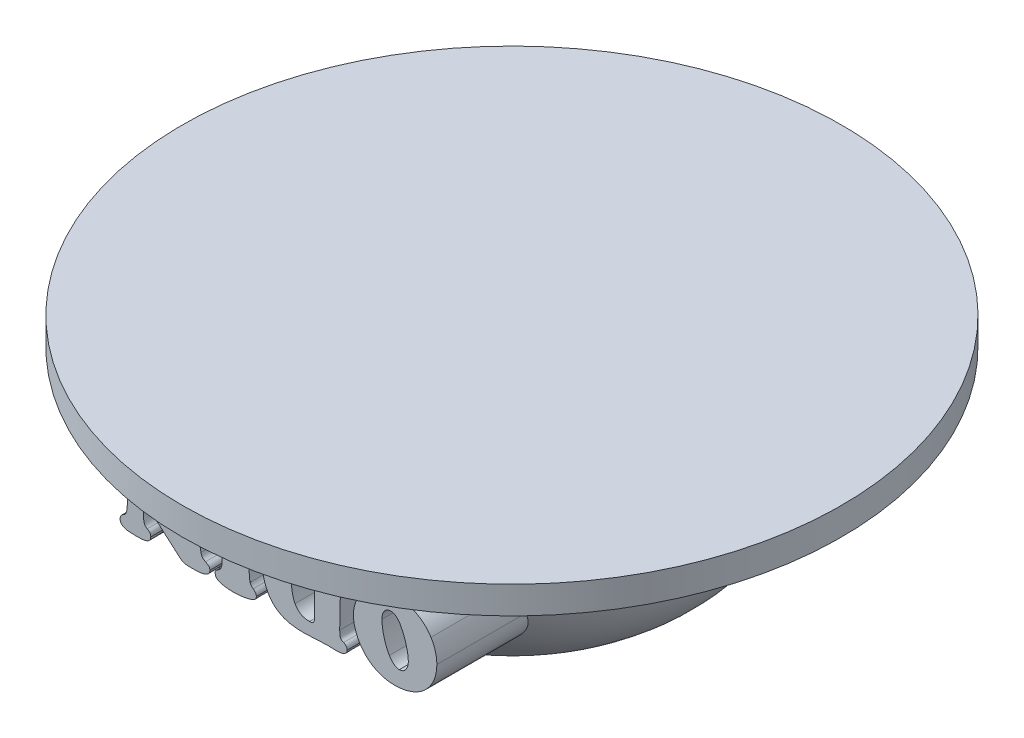
from build123d import *

# Parameters (mm, degrees)
ESQUISSE1_R        = 16
BOSS_EXTRU_1_DEPTH = 15
CONG_4_R           = 10
ESQUISSE5_R        = 24
BOSS_EXTRU_4_DEPTH = 2
BOSS_EXTRU_5_DEPTH = 17


with BuildPart() as part:
    # Esquisse1 → Boss.-Extru.1 (new body)
    with BuildSketch(Plane(origin=(0, 0, 0), x_dir=(1, 0, 0), z_dir=(0, 1, 0))):
        with Locations(Location((0, 0, 0), (0, 0, 270))):
            Circle(ESQUISSE1_R)
    extrude(amount=BOSS_EXTRU_1_DEPTH)

    # Congé4
    cong_4_edges = [part.edges().sort_by_distance(p)[0] for p in [
        (0, 0, -16),
    ]]
    fillet(cong_4_edges, radius=CONG_4_R)

    # Esquisse5 → Boss.-Extru.4 (add)
    with BuildSketch(Plane(origin=(0, 15, 0), x_dir=(1, 0, 0), z_dir=(0, 1, 0))):
        with Locations(Location((0, 0, 0), (0, 0, 270))):
            Circle(ESQUISSE5_R)
    extrude(amount=-BOSS_EXTRU_4_DEPTH)

    # Esquisse6 → Boss.-Extru.5 (add)
    # profile 1 of 4: a face of its own
    with BuildSketch(Plane.XY):
        with BuildLine():
            add(Edge.make_bspline(
                [(8.452336932, 4.388330518), (8.366979406, 4.390217829), (8.198217113, 4.393949274), (7.949668758, 4.422321264), (7.708834829, 4.467403215), (7.47713297, 4.533236034), (7.251891413, 4.613813805), (7.037143675, 4.717994283), (6.827615612, 4.835146417), (6.697818257, 4.929496384), (6.632628185, 4.976883182)],
                knots=[0, 0, 0, 0, 1.051895872, 2.079727092, 3.079536395, 4.068569728, 5.045898846, 6.023800936, 7.007463913, 8, 8, 8, 8], degree=3))
            add(Edge.make_bspline(
                [(6.632628185, 4.976883182), (6.589330819, 5.011171196), (6.502484112, 5.079946769), (6.38039795, 5.193057504), (6.264936059, 5.314098282), (6.154081228, 5.44077198), (6.050649596, 5.576558935), (5.952159554, 5.718824645), (5.860630697, 5.869412919), (5.805329649, 5.973930246), (5.77742513, 6.026668954)],
                knots=[0, 0, 0, 0, 0.970644245, 1.946937291, 2.922621233, 3.910516206, 4.904410596, 5.921583779, 6.951245804, 8, 8, 8, 8], degree=3))
            add(Edge.make_bspline(
                [(5.77742513, 6.026668954), (5.751969108, 6.07963941), (5.701450823, 6.184760967), (5.637607446, 6.345582131), (5.580933586, 6.505816314), (5.53791165, 6.666833256), (5.500004199, 6.826626585), (5.477468459, 6.987515653), (5.460311231, 7.147753032), (5.458717371, 7.254975434), (5.457925113, 7.308272408)],
                knots=[0, 0, 0, 0, 1.058087134, 2.099807599, 3.114551819, 4.116923791, 5.100022616, 6.069809804, 7.040561529, 8, 8, 8, 8], degree=3))
            add(Edge.make_bspline(
                [(5.457925113, 7.308272408), (5.459614248, 7.386051364), (5.462961908, 7.540199785), (5.494527196, 7.768001675), (5.543029466, 7.990192615), (5.613716531, 8.205167309), (5.701029213, 8.41507827), (5.811797345, 8.616720214), (5.939963578, 8.813784923), (6.039359962, 8.937022894), (6.08971838, 8.999460471)],
                knots=[0, 0, 0, 0, 1.011582123, 2.004832598, 2.986966838, 3.967275341, 4.945546629, 5.940967282, 6.9568068, 8, 8, 8, 8], degree=3))
            add(Edge.make_bspline(
                [(6.08971838, 8.999460471), (6.135435825, 9.050996364), (6.226649976, 9.153819319), (6.376177751, 9.29544137), (6.535995672, 9.426250775), (6.705983917, 9.545535995), (6.885948488, 9.655175404), (7.077767532, 9.749864126), (7.277886356, 9.837840223), (7.417369074, 9.884927373), (7.487831239, 9.908714281)],
                knots=[0, 0, 0, 0, 0.977993035, 1.95126404, 2.921007604, 3.908524287, 4.898281, 5.91032505, 6.944363697, 8, 8, 8, 8], degree=3))
            add(Edge.make_bspline(
                [(7.487831239, 9.908714281), (7.575966192, 9.934518045), (7.751103703, 9.985794038), (8.018314472, 10.037843815), (8.285774011, 10.070312365), (8.46425732, 10.074689949), (8.553231674, 10.076872185)],
                knots=[0, 0, 0, 0, 1.017501807, 2.021930326, 3.013927564, 4, 4, 4, 4], degree=3))
            add(Edge.make_bspline(
                [(8.553231674, 10.076872185), (8.611307339, 10.075844791), (8.726804982, 10.073801567), (8.899286168, 10.060548619), (9.069943929, 10.037226279), (9.238991924, 10.00679762), (9.40550123, 9.965054116), (9.570472829, 9.916078876), (9.733653215, 9.857401267), (9.840262151, 9.811570224), (9.893690394, 9.788601492)],
                knots=[0, 0, 0, 0, 1.009044969, 2.00673235, 3.003327838, 4.000699905, 4.989373689, 5.984146689, 6.989732889, 8, 8, 8, 8], degree=3))
            add(Edge.make_bspline(
                [(9.893690394, 9.788601492), (9.957084916, 9.758800156), (10.082717972, 9.699740906), (10.260013432, 9.593998792), (10.428341177, 9.479718065), (10.586096853, 9.353960704), (10.731167869, 9.214641873), (10.867854285, 9.066398533), (10.994633246, 8.907271704), (11.068529002, 8.792722077), (11.105628431, 8.735212336)],
                knots=[0, 0, 0, 0, 1.030857394, 2.04291731, 3.035438857, 4.025155278, 5.009237461, 5.993884518, 6.992827961, 8, 8, 8, 8], degree=3))
            add(Edge.make_bspline(
                [(11.105628431, 8.735212336), (11.139677016, 8.678011215), (11.207257535, 8.56447694), (11.293770766, 8.386898014), (11.366949892, 8.20542072), (11.427905212, 8.019865973), (11.47270492, 7.829178215), (11.507195063, 7.634419723), (11.526044606, 7.434761638), (11.529225958, 7.300299995), (11.530827703, 7.232601351)],
                knots=[0, 0, 0, 0, 1.00927234, 2.003230034, 2.99214822, 3.975344988, 4.962135542, 5.960442695, 6.973125272, 8, 8, 8, 8], degree=3))
            add(Edge.make_bspline(
                [(11.530827703, 7.232601351), (11.529246645, 7.15406167), (11.526132592, 6.999369782), (11.500390231, 6.770737476), (11.457092107, 6.549492161), (11.397012591, 6.334921237), (11.319609918, 6.12732646), (11.225996352, 5.926726576), (11.115233952, 5.732605235), (11.028248321, 5.611159662), (10.984314515, 5.549821183)],
                knots=[0, 0, 0, 0, 1.046408287, 2.061007504, 3.06133757, 4.047798165, 5.026959698, 6.010371128, 6.995098758, 8, 8, 8, 8], degree=3))
            add(Edge.make_bspline(
                [(10.984314515, 5.549821183), (10.94271603, 5.496655825), (10.860079495, 5.391041375), (10.721280791, 5.245438705), (10.574141354, 5.109032205), (10.414206348, 4.985310316), (10.245030274, 4.871083261), (10.065235642, 4.767549353), (9.87517742, 4.674336592), (9.742348268, 4.622417082), (9.675085119, 4.596125642)],
                knots=[0, 0, 0, 0, 0.985932074, 1.958581229, 2.935812373, 3.915405102, 4.910134066, 5.916682345, 6.945032, 8, 8, 8, 8], degree=3))
            add(Edge.make_bspline(
                [(9.675085119, 4.596125642), (9.58116427, 4.563723057), (9.391096872, 4.498150023), (9.090785834, 4.435174788), (8.776505334, 4.395790424), (8.561763751, 4.390848696), (8.452336932, 4.388330518)],
                knots=[0, 0, 0, 0, 0.955506866, 1.933656958, 2.94704443, 4, 4, 4, 4], degree=3))
        make_face()
        with BuildLine():
            add(Edge.make_bspline(
                [(8.798261763, 5.541413288), (8.824368923, 5.542263022), (8.875792548, 5.543936754), (8.950636814, 5.559397532), (9.022436377, 5.58125942), (9.088556193, 5.615886988), (9.150833971, 5.658433619), (9.208681543, 5.710414279), (9.261978049, 5.772445412), (9.292821821, 5.818913149), (9.308741114, 5.842896388)],
                knots=[0, 0, 0, 0, 1.006775924, 1.983060122, 2.941306894, 3.895429469, 4.851678852, 5.847954811, 6.889272089, 8, 8, 8, 8], degree=3))
            add(Edge.make_bspline(
                [(9.308741114, 5.842896388), (9.331184683, 5.881533178), (9.37675921, 5.959990103), (9.422949196, 6.090315147), (9.449639809, 6.231368164), (9.453357303, 6.328431538), (9.455278716, 6.378599425)],
                knots=[0, 0, 0, 0, 0.951073107, 1.931275122, 2.930765027, 4, 4, 4, 4], degree=3))
            add(Edge.make_bspline(
                [(9.455278716, 6.378599425), (9.453110013, 6.457580749), (9.448589663, 6.622205995), (9.412342032, 6.877018359), (9.356523587, 7.149619007), (9.280705752, 7.434224284), (9.188999317, 7.719870405), (9.083591689, 7.993973578), (8.966070879, 8.251213118), (8.876927833, 8.413020621), (8.833094471, 8.492584503)],
                knots=[0, 0, 0, 0, 0.851887102, 1.775636513, 2.771927568, 3.853257604, 4.951607259, 6.007335301, 7.020168178, 8, 8, 8, 8], degree=3))
            add(Edge.make_bspline(
                [(8.833094471, 8.492584503), (8.812442325, 8.524206457), (8.771881786, 8.58631155), (8.702067255, 8.671577431), (8.623120042, 8.744464901), (8.540157832, 8.808500902), (8.452448651, 8.858355047), (8.364380049, 8.897048621), (8.274081927, 8.919494581), (8.213427558, 8.922363603), (8.183284285, 8.923789414)],
                knots=[0, 0, 0, 0, 1.114232618, 2.188337959, 3.241574703, 4.278985454, 5.274085398, 6.211166208, 7.111007086, 8, 8, 8, 8], degree=3))
            add(Edge.make_bspline(
                [(8.183284285, 8.923789414), (8.136419, 8.921350137), (8.045706044, 8.916628646), (7.917785003, 8.87004776), (7.802826889, 8.798518298), (7.707484874, 8.695089234), (7.629239328, 8.570925477), (7.572453035, 8.426423128), (7.538795835, 8.263914387), (7.535294582, 8.149629373), (7.533474099, 8.090206662)],
                knots=[0, 0, 0, 0, 0.946349272, 1.831763911, 2.725506388, 3.666832243, 4.655183083, 5.685900382, 6.796779471, 8, 8, 8, 8], degree=3))
            add(Edge.make_bspline(
                [(7.533474099, 8.090206662), (7.5355129, 8.007261443), (7.539679788, 7.837738473), (7.568420957, 7.579259047), (7.615788094, 7.311382114), (7.681100663, 7.039263041), (7.759861768, 6.772009046), (7.850419658, 6.520345196), (7.953588083, 6.289566308), (8.032950336, 6.14667011), (8.071579392, 6.077116325)],
                knots=[0, 0, 0, 0, 0.945659483, 1.932733523, 2.961681864, 4.04567364, 5.121744827, 6.13695095, 7.093173116, 8, 8, 8, 8], degree=3))
            add(Edge.make_bspline(
                [(8.071579392, 6.077116325), (8.095941825, 6.037672152), (8.143528325, 5.960626885), (8.227407658, 5.858283021), (8.31375511, 5.765957156), (8.407491684, 5.690317262), (8.502596366, 5.626229935), (8.601438228, 5.582642102), (8.698962072, 5.549707146), (8.765582999, 5.544142733), (8.798261763, 5.541413288)],
                knots=[0, 0, 0, 0, 1.183808741, 2.312302484, 3.376393325, 4.409059223, 5.385626283, 6.297054649, 7.164674646, 8, 8, 8, 8], degree=3))
        make_face(mode=Mode.SUBTRACT)
    # profile 2 of 4: a face of its own
    with BuildSketch(Plane.XY):
        with BuildLine():
            Line((3.413605451, 10), (3.703077272, 10))
            add(Edge.make_bspline(
                [(3.703077272, 10), (3.746742136, 10.000252618), (3.836578998, 10.000772358), (3.97461196, 10.01230488), (4.120283027, 10.023914917), (4.219224335, 10.038273027), (4.270009634, 10.04564286)],
                knots=[0, 0, 0, 0, 0.920125843, 1.893083154, 2.918546723, 4, 4, 4, 4], degree=3))
            add(Edge.make_bspline(
                [(4.270009634, 10.04564286), (4.300453207, 10.049914324), (4.356126219, 10.057725669), (4.431874564, 10.070198482), (4.492984273, 10.074318935), (4.528652394, 10.076108737), (4.543866792, 10.076872185)],
                knots=[0, 0, 0, 0, 1.337601017, 2.446108267, 3.337180453, 4, 4, 4, 4], degree=3))
            add(Edge.make_bspline(
                [(4.543866792, 10.076872185), (4.586808236, 10.075195272), (4.668940131, 10.071987927), (4.786350827, 10.049436818), (4.891053515, 10.009831752), (4.981315731, 9.954149725), (5.056927894, 9.887941278), (5.111691319, 9.808909237), (5.144442815, 9.719365796), (5.148405268, 9.656348752), (5.150436374, 9.624046972)],
                knots=[0, 0, 0, 0, 1.219451387, 2.332381986, 3.379942845, 4.380522973, 5.330648641, 6.213899374, 7.084466267, 8, 8, 8, 8], degree=3))
            add(Edge.make_bspline(
                [(5.150436374, 9.624046972), (5.14952571, 9.60155408), (5.147800458, 9.558941337), (5.134586418, 9.498609736), (5.111966096, 9.445847509), (5.078063143, 9.401178662), (5.034268594, 9.363304638), (4.980134634, 9.329151436), (4.913944782, 9.299841436), (4.86513334, 9.284058604), (4.839344251, 9.275719885)],
                knots=[0, 0, 0, 0, 1.055878958, 2.000360711, 2.884492829, 3.730810764, 4.61012906, 5.590985579, 6.727218747, 8, 8, 8, 8], degree=3))
            add(Edge.make_bspline(
                [(4.839344251, 9.275719885), (4.815121274, 9.268314669), (4.770001153, 9.254520978), (4.708768521, 9.225973478), (4.661511889, 9.188554215), (4.624540088, 9.142781988), (4.597371789, 9.08261062), (4.576398592, 9.004213599), (4.555509328, 8.904839391), (4.546442677, 8.831004209), (4.541464536, 8.790464219)],
                knots=[0, 0, 0, 0, 0.978903518, 1.823402852, 2.594502993, 3.288247987, 4.077465234, 5.125623634, 6.42179318, 8, 8, 8, 8], degree=3))
            add(Edge.make_bspline(
                [(4.541464536, 8.790464219), (4.539083888, 8.762036149), (4.533853677, 8.699580546), (4.524727883, 8.596790432), (4.518372083, 8.476180768), (4.510877358, 8.337267049), (4.50399253, 8.180702106), (4.496236898, 8.005770088), (4.491221321, 7.813126123), (4.475298829, 7.387278911), (4.462352319, 6.735810548), (4.459839516, 6.154392988), (4.458586712, 5.86451669)],
                knots=[0, 0, 0, 0, 0.292319061, 0.642216047, 1.057303786, 1.529738379, 2.067735435, 2.663113798, 3.323942291, 4.042309848, 7.029685223, 10, 10, 10, 10], degree=3))
            add(Edge.make_bspline(
                [(4.458586712, 5.86451669), (4.459449699, 5.812873641), (4.461023159, 5.718714286), (4.467734978, 5.590857453), (4.48318901, 5.491323698), (4.502007978, 5.413776611), (4.537954741, 5.353748593), (4.590384861, 5.306463029), (4.657174237, 5.263101281), (4.709159133, 5.241820119), (4.737248381, 5.230321166)],
                knots=[0, 0, 0, 0, 1.635549864, 2.982053256, 4.046925476, 4.825190199, 5.490369365, 6.225534096, 7.041194322, 8, 8, 8, 8], degree=3))
            add(Edge.make_bspline(
                [(4.737248381, 5.230321166), (4.75796656, 5.221277356), (4.797854972, 5.203865437), (4.850682169, 5.169627519), (4.896853618, 5.132478611), (4.932412372, 5.088327555), (4.962673746, 5.040946914), (4.98245549, 4.98772085), (4.995125566, 4.930238949), (4.996159306, 4.890474107), (4.996692005, 4.8699828)],
                knots=[0, 0, 0, 0, 1.139394589, 2.193660095, 3.169421207, 4.116708503, 5.042396773, 5.995918412, 6.967272364, 8, 8, 8, 8], degree=3))
            add(Edge.make_bspline(
                [(4.996692005, 4.8699828), (4.994582528, 4.838345494), (4.990454747, 4.776438263), (4.951535081, 4.690411105), (4.890211827, 4.615480065), (4.803864165, 4.555388333), (4.698701099, 4.506252252), (4.574085018, 4.472052292), (4.431200041, 4.452234917), (4.329734764, 4.449718956), (4.276015273, 4.448386912)],
                knots=[0, 0, 0, 0, 0.813299906, 1.591448539, 2.392624287, 3.288351079, 4.283039008, 5.379758877, 6.612746904, 8, 8, 8, 8], degree=3))
            add(Edge.make_bspline(
                [(4.276015273, 4.448386912), (4.235176047, 4.44872131), (4.146686619, 4.449445876), (4.058209555, 4.451099724), (4.01056601, 4.451990296)],
                knots=[0, 0, 0, 0, 0.92303062, 2, 2, 2, 2], degree=3))
            add(Edge.make_bspline(
                [(4.01056601, 4.451990296), (3.958522374, 4.45415076), (3.862058096, 4.458155238), (3.728706853, 4.461429672), (3.618205799, 4.46406445), (3.55213645, 4.464853594), (3.522908089, 4.465202703)],
                knots=[0, 0, 0, 0, 1.281213718, 2.374764056, 3.281013318, 4, 4, 4, 4], degree=3))
            add(Edge.make_bspline(
                [(3.522908089, 4.465202703), (3.424402857, 4.464568311), (3.220916964, 4.463257824), (2.906588206, 4.450015547), (2.57334705, 4.431484577), (2.345363731, 4.412506246), (2.228092228, 4.402744053)],
                knots=[0, 0, 0, 0, 0.911540002, 1.883001812, 2.911045071, 4, 4, 4, 4], degree=3))
            add(Edge.make_bspline(
                [(2.228092228, 4.402744053), (2.201274658, 4.400638012), (2.144079525, 4.396146356), (2.053580921, 4.391297119), (1.953442805, 4.3892948), (1.883769192, 4.388661625), (1.847334688, 4.388330518)],
                knots=[0, 0, 0, 0, 0.846918924, 1.806265073, 2.852827644, 4, 4, 4, 4], degree=3))
            add(Edge.make_bspline(
                [(1.847334688, 4.388330518), (1.772856725, 4.389108385), (1.627841397, 4.390622962), (1.416262604, 4.39986217), (1.216797981, 4.416950452), (1.029112661, 4.439056065), (0.854005634, 4.469163407), (0.690700377, 4.505005771), (0.539324413, 4.547611255), (0.44382013, 4.582725416), (0.39757333, 4.599729026)],
                knots=[0, 0, 0, 0, 1.213424847, 2.362647857, 3.449300149, 4.474398554, 5.44060886, 6.342687041, 7.197466145, 8, 8, 8, 8], degree=3))
            add(Edge.make_bspline(
                [(0.39757333, 4.599729026), (0.333034838, 4.627546074), (0.205614379, 4.682466182), (0.024482201, 4.781682295), (-0.144496322, 4.89440999), (-0.299343655, 5.022824227), (-0.443821822, 5.162516453), (-0.574391961, 5.317190359), (-0.694663911, 5.483988419), (-0.762240281, 5.604369884), (-0.796347788, 5.665129461)],
                knots=[0, 0, 0, 0, 1.03142596, 2.036378062, 3.027688743, 4.00920738, 4.986138137, 5.974463699, 6.977660484, 8, 8, 8, 8], degree=3))
            add(Edge.make_bspline(
                [(-0.796347788, 5.665129461), (-0.825303525, 5.720744869), (-0.883630982, 5.832774666), (-0.954833745, 6.010506095), (-1.016061422, 6.195461676), (-1.066789132, 6.387915363), (-1.105044224, 6.588638352), (-1.132250127, 6.797198082), (-1.149508414, 7.013707928), (-1.151879411, 7.160501157), (-1.15308277, 7.235003607)],
                knots=[0, 0, 0, 0, 0.924728864, 1.862742562, 2.821148645, 3.798433486, 4.797196575, 5.83410876, 6.900738101, 8, 8, 8, 8], degree=3))
            add(Edge.make_bspline(
                [(-1.15308277, 7.235003607), (-1.15146646, 7.311546299), (-1.148216785, 7.465439366), (-1.121676923, 7.695732662), (-1.081072996, 7.92656752), (-1.023605386, 8.154789152), (-0.952852439, 8.376173406), (-0.868292241, 8.584183338), (-0.774655482, 8.778099833), (-0.699763364, 8.896790945), (-0.663022593, 8.955018739)],
                knots=[0, 0, 0, 0, 1.013585565, 2.037866532, 3.066695254, 4.116240773, 5.152681626, 6.142387353, 7.088687549, 8, 8, 8, 8], degree=3))
            add(Edge.make_bspline(
                [(-0.663022593, 8.955018739), (-0.623135524, 9.010615782), (-0.544034284, 9.120871939), (-0.409202826, 9.272325352), (-0.265156016, 9.412233836), (-0.10948499, 9.539241776), (0.058121518, 9.651630986), (0.235690079, 9.753261027), (0.424191908, 9.842836779), (0.556486776, 9.890578158), (0.623385373, 9.91471992)],
                knots=[0, 0, 0, 0, 1.004579795, 1.992212232, 2.973854545, 3.95214334, 4.939075006, 5.934869834, 6.955709227, 8, 8, 8, 8], degree=3))
            add(Edge.make_bspline(
                [(0.623385373, 9.91471992), (0.704670167, 9.939874386), (0.868303446, 9.990512489), (1.123182934, 10.038960321), (1.385215017, 10.072224126), (1.562959014, 10.075312165), (1.652751971, 10.076872185)],
                knots=[0, 0, 0, 0, 0.975039071, 1.962837489, 2.970863437, 4, 4, 4, 4], degree=3))
            Line((1.652751971, 10.076872185), (2.139208764, 10.049246243))
            Line((2.139208764, 10.049246243), (2.557201269, 10.027625941))
            add(Edge.make_bspline(
                [(2.557201269, 10.027625941), (2.635663432, 10.023354393), (2.788140995, 10.015053383), (3.0096022, 10.007409912), (3.216574229, 10.000144269), (3.349539281, 10.00004691), (3.413605451, 10)],
                knots=[0, 0, 0, 0, 1.1002948, 2.138231499, 3.10294941, 4, 4, 4, 4], degree=3))
        make_face()
        with BuildLine():
            Line((2.613654279, 5.644710286), (2.613654279, 8.764039406))
            add(Edge.make_bspline(
                [(2.613654279, 8.764039406), (2.61235292, 8.803366622), (2.609928611, 8.876629507), (2.590500011, 8.977818709), (2.555869837, 9.061409684), (2.504551847, 9.127357296), (2.435608596, 9.176067051), (2.349512147, 9.209109044), (2.245256915, 9.227291418), (2.170112164, 9.229881679), (2.129599741, 9.231278153)],
                knots=[0, 0, 0, 0, 1.205062784, 2.244918024, 3.140973218, 3.953721306, 4.771274222, 5.696607523, 6.758183262, 8, 8, 8, 8], degree=3))
            add(Edge.make_bspline(
                [(2.129599741, 9.231278153), (2.080682076, 9.229870178), (1.985604804, 9.227133612), (1.847706912, 9.206646174), (1.719256541, 9.172059937), (1.600794488, 9.122284924), (1.491271831, 9.05963889), (1.391878403, 8.981498653), (1.301629339, 8.889781423), (1.220459202, 8.784182725), (1.14952328, 8.664261202), (1.088676055, 8.530375913), (1.036820661, 8.38285873), (0.995812123, 8.221487118), (0.961368149, 8.046810846), (0.940028741, 7.857600907), (0.924875462, 7.654844284), (0.923285403, 7.514898044), (0.922466216, 7.442798731)],
                knots=[0, 0, 0, 0, 0.958663437, 1.863275827, 2.72578016, 3.5595238, 4.375305652, 5.191691341, 6.029709106, 6.891534709, 7.796044954, 8.754772642, 9.770012496, 10.856982038, 12.016025252, 13.257216196, 14.586937197, 16, 16, 16, 16], degree=3))
            add(Edge.make_bspline(
                [(0.922466216, 7.442798731), (0.923402289, 7.362701448), (0.9252196, 7.207199027), (0.938840628, 6.98082338), (0.959334149, 6.768185182), (0.991441718, 6.570023243), (1.028194747, 6.384814783), (1.078831798, 6.214604194), (1.133168844, 6.055997809), (1.180548573, 5.958602389), (1.203530141, 5.911360677)],
                knots=[0, 0, 0, 0, 1.22377343, 2.375857482, 3.464265223, 4.4861315, 5.442383993, 6.34657505, 7.198005137, 8, 8, 8, 8], degree=3))
            add(Edge.make_bspline(
                [(1.203530141, 5.911360677), (1.230303614, 5.86371364), (1.282654325, 5.770548431), (1.381076757, 5.646703762), (1.493699804, 5.542165028), (1.620232377, 5.457713363), (1.758941167, 5.390273644), (1.912120077, 5.343845455), (2.078552499, 5.316242991), (2.193951651, 5.312646738), (2.253315914, 5.310796734)],
                knots=[0, 0, 0, 0, 1.023954712, 2.002159235, 2.953470404, 3.89497782, 4.84557724, 5.836158065, 6.886864599, 8, 8, 8, 8], degree=3))
            add(Edge.make_bspline(
                [(2.253315914, 5.310796734), (2.284230556, 5.311490731), (2.341253055, 5.312770817), (2.419257905, 5.327417592), (2.484014024, 5.348984385), (2.534750367, 5.383762814), (2.571722102, 5.431783626), (2.595886113, 5.491957558), (2.611878552, 5.564216306), (2.613033758, 5.616581953), (2.613654279, 5.644710286)],
                knots=[0, 0, 0, 0, 1.292446209, 2.383935493, 3.311943636, 4.130388962, 4.918400696, 5.812011858, 6.824716918, 8, 8, 8, 8], degree=3))
        make_face(mode=Mode.SUBTRACT)
    # profile 3 of 4: a face of its own
    with BuildSketch(Plane.XY):
        with BuildLine():
            add(Edge.make_bspline(
                [(-3.283883639, 4.388330518), (-3.354783787, 4.38911131), (-3.494760125, 4.390652806), (-3.701162237, 4.407123039), (-3.901728742, 4.431617961), (-4.032301402, 4.456478653), (-4.097047218, 4.468806086)],
                knots=[0, 0, 0, 0, 1.039250674, 2.051765891, 3.033947791, 4, 4, 4, 4], degree=3))
            add(Edge.make_bspline(
                [(-4.097047218, 4.468806086), (-4.13770666, 4.478406708), (-4.214505361, 4.496540633), (-4.320204286, 4.534592411), (-4.409716604, 4.581851149), (-4.483302475, 4.636783667), (-4.542381482, 4.698950892), (-4.582685092, 4.770825834), (-4.607590805, 4.850348339), (-4.610725964, 4.90623252), (-4.612331081, 4.934843706)],
                knots=[0, 0, 0, 0, 1.321013805, 2.495168172, 3.543498325, 4.511213695, 5.389680449, 6.234918693, 7.096326217, 8, 8, 8, 8], degree=3))
            add(Edge.make_bspline(
                [(-4.612331081, 4.934843706), (-4.612281968, 4.953353593), (-4.61219039, 4.987868288), (-4.600957109, 5.035381006), (-4.589694934, 5.07719259), (-4.566348719, 5.11329995), (-4.530212959, 5.147364044), (-4.479316058, 5.186182008), (-4.411989786, 5.233346176), (-4.35992275, 5.264708893), (-4.331267156, 5.281969665)],
                knots=[0, 0, 0, 0, 0.928144258, 1.730675938, 2.45102501, 3.094188585, 3.863897141, 4.940606375, 6.316233311, 8, 8, 8, 8], degree=3))
            add(Edge.make_bspline(
                [(-4.331267156, 5.281969665), (-4.305949059, 5.301118937), (-4.252363297, 5.341648378), (-4.193654205, 5.435119926), (-4.15079389, 5.553450704), (-4.126399708, 5.671544475), (-4.111137961, 5.784984562), (-4.102650294, 5.892115138), (-4.092156098, 6.017722795), (-4.085546396, 6.162345629), (-4.081073345, 6.325730448), (-4.077472243, 6.507508736), (-4.075106982, 6.708103055), (-4.074528332, 6.848239745), (-4.074225788, 6.921509229)],
                knots=[0, 0, 0, 0, 0.665987176, 1.409562121, 2.287581477, 3.317749462, 3.949282948, 4.705023038, 5.587187277, 6.611785616, 7.762484446, 9.039798361, 10.452279359, 12, 12, 12, 12], degree=3))
            add(Edge.make_bspline(
                [(-4.074225788, 6.921509229), (-4.07462325, 7.044022995), (-4.075379213, 7.277041684), (-4.076498418, 7.608191077), (-4.083973698, 7.902425975), (-4.088282055, 8.159958264), (-4.098485855, 8.3805582), (-4.108810209, 8.564788216), (-4.120498595, 8.712433245), (-4.133503155, 8.798117296), (-4.139086694, 8.834905951)],
                knots=[0, 0, 0, 0, 1.534841543, 2.919237379, 4.148363098, 5.222036221, 6.145814448, 6.914557686, 7.533962707, 8, 8, 8, 8], degree=3))
            add(Edge.make_bspline(
                [(-4.139086694, 8.834905951), (-4.147105871, 8.870463631), (-4.161597532, 8.934720836), (-4.203093848, 9.004497179), (-4.243094716, 9.050083353), (-4.282999334, 9.082102207), (-4.330715291, 9.117175404), (-4.367094486, 9.139097404), (-4.386519039, 9.150802585)],
                knots=[0, 0, 0, 0, 1.562559448, 2.823741711, 3.447324076, 4.17005981, 5.022909427, 6, 6, 6, 6], degree=3))
            add(Edge.make_bspline(
                [(-4.386519039, 9.150802585), (-4.4206938, 9.171514955), (-4.485852994, 9.211006125), (-4.559404132, 9.295660076), (-4.604555788, 9.394983663), (-4.609696857, 9.466228194), (-4.612331081, 9.502733055)],
                knots=[0, 0, 0, 0, 1.083656221, 2.066149483, 3.009117719, 4, 4, 4, 4], degree=3))
            add(Edge.make_bspline(
                [(-4.612331081, 9.502733055), (-4.611169185, 9.528955641), (-4.608903997, 9.580078175), (-4.584467605, 9.652849), (-4.546557418, 9.7190448), (-4.49345586, 9.778510267), (-4.426326117, 9.832139358), (-4.343250295, 9.876900793), (-4.246295543, 9.917021737), (-4.175384446, 9.936728914), (-4.137885566, 9.947150373)],
                knots=[0, 0, 0, 0, 0.890062822, 1.735231852, 2.58424183, 3.473155037, 4.43354919, 5.495703658, 6.675689534, 8, 8, 8, 8], degree=3))
            add(Edge.make_bspline(
                [(-4.137885566, 9.947150373), (-4.047643078, 9.967281045), (-3.859153583, 10.00932798), (-3.558280055, 10.048357038), (-3.229429754, 10.072238537), (-3.000464062, 10.0752879), (-2.881505798, 10.076872185)],
                knots=[0, 0, 0, 0, 0.876071197, 1.829849992, 2.872506732, 4, 4, 4, 4], degree=3))
            add(Edge.make_bspline(
                [(-2.881505798, 10.076872185), (-2.830251617, 10.076356666), (-2.731310843, 10.075361511), (-2.587512379, 10.069276625), (-2.453725317, 10.059797719), (-2.329757079, 10.047287265), (-2.21605817, 10.028757279), (-2.112071967, 10.007811161), (-2.017849444, 9.982428358), (-1.933074031, 9.954244692), (-1.858581572, 9.920271409), (-1.792730514, 9.883905224), (-1.738737769, 9.841105209), (-1.692656017, 9.796541301), (-1.657699839, 9.746656455), (-1.631707039, 9.6933277), (-1.616907884, 9.635243719), (-1.615195055, 9.595302248), (-1.614315878, 9.574800728)],
                knots=[0, 0, 0, 0, 1.651722599, 3.188475745, 4.637238369, 5.973753852, 7.201934354, 8.348226151, 9.390458122, 10.345243706, 11.222993646, 12.026375529, 12.76193165, 13.43706701, 14.085024739, 14.714079892, 15.339951278, 16, 16, 16, 16], degree=3))
            add(Edge.make_bspline(
                [(-1.614315878, 9.574800728), (-1.617583424, 9.544604303), (-1.624391604, 9.481687764), (-1.675706107, 9.392782064), (-1.753294027, 9.30719716), (-1.821295332, 9.260296648), (-1.858144839, 9.234881537)],
                knots=[0, 0, 0, 0, 0.829923195, 1.729207842, 2.769471094, 4, 4, 4, 4], degree=3))
            add(Edge.make_bspline(
                [(-1.858144839, 9.234881537), (-1.887227938, 9.214036737), (-1.943667628, 9.173584581), (-2.009713864, 9.093828188), (-2.058913024, 9.003851361), (-2.0731446, 8.937154856), (-2.080353498, 8.90337024)],
                knots=[0, 0, 0, 0, 1.040363738, 2.018966697, 2.996522387, 4, 4, 4, 4], degree=3))
            add(Edge.make_bspline(
                [(-2.080353498, 8.90337024), (-2.086343512, 8.859771568), (-2.099829507, 8.76161295), (-2.112506305, 8.597572284), (-2.126676835, 8.401471276), (-2.134780551, 8.172706217), (-2.144173807, 7.911703641), (-2.14769158, 7.618166154), (-2.151976259, 7.29267016), (-2.152268251, 7.064846015), (-2.152421171, 6.945531787)],
                knots=[0, 0, 0, 0, 0.538662545, 1.21275188, 2.013528772, 2.945656604, 4.014754598, 5.210903982, 6.539317068, 8, 8, 8, 8], degree=3))
            add(Edge.make_bspline(
                [(-2.152421171, 6.945531787), (-2.152390322, 6.863048988), (-2.152331614, 6.706075088), (-2.146521711, 6.482287798), (-2.141777312, 6.281597977), (-2.13159738, 6.103852955), (-2.120940274, 5.949050269), (-2.104254299, 5.81791408), (-2.089851957, 5.709431616), (-2.073264991, 5.646206527), (-2.065939963, 5.618285473)],
                knots=[0, 0, 0, 0, 1.485220095, 2.826538323, 4.031101316, 5.099697795, 6.032542128, 6.823971206, 7.480649786, 8, 8, 8, 8], degree=3))
            add(Edge.make_bspline(
                [(-2.065939963, 5.618285473), (-2.056597533, 5.590960224), (-2.037444185, 5.534939464), (-1.986946428, 5.457957749), (-1.923286143, 5.383678827), (-1.870914379, 5.341234803), (-1.843731305, 5.319204629)],
                knots=[0, 0, 0, 0, 0.911581787, 1.868876074, 2.89386003, 4, 4, 4, 4], degree=3))
            add(Edge.make_bspline(
                [(-1.843731305, 5.319204629), (-1.822879459, 5.30164472), (-1.784257079, 5.269119757), (-1.730921045, 5.22300219), (-1.692128078, 5.178285912), (-1.651173443, 5.1265924), (-1.619898175, 5.05004252), (-1.616264675, 4.985223501), (-1.614315878, 4.950458369)],
                knots=[0, 0, 0, 0, 1.083600409, 2.007075362, 2.795755873, 3.432067943, 4.62271138, 6, 6, 6, 6], degree=3))
            add(Edge.make_bspline(
                [(-1.614315878, 4.950458369), (-1.615886259, 4.922509163), (-1.618947033, 4.868034329), (-1.651465, 4.791807729), (-1.702502338, 4.725421765), (-1.774513623, 4.666710766), (-1.872946274, 4.618513829), (-1.996605091, 4.570821902), (-2.150790454, 4.527075864), (-2.263967775, 4.502539791), (-2.325383587, 4.48922526)],
                knots=[0, 0, 0, 0, 0.726486168, 1.415969151, 2.12508296, 2.897755461, 3.81937022, 4.975000034, 6.358480072, 8, 8, 8, 8], degree=3))
            add(Edge.make_bspline(
                [(-2.325383587, 4.48922526), (-2.404500396, 4.473465692), (-2.562055433, 4.442081724), (-2.801627233, 4.411828114), (-3.042099527, 4.391467783), (-3.203365508, 4.389375279), (-3.283883639, 4.388330518)],
                knots=[0, 0, 0, 0, 1.002344359, 1.996091666, 2.999473086, 4, 4, 4, 4], degree=3))
        make_face()
    # profile 4 of 4: a face of its own
    with BuildSketch(Plane.XY):
        with BuildLine():
            Line((-7.241600023, 4.666992188), (-9.24267908, 6.417035517))
            add(Edge.make_bspline(
                [(-9.24267908, 6.417035517), (-9.264612715, 6.436349143), (-9.306397235, 6.473142433), (-9.367135881, 6.523960497), (-9.423977372, 6.565402317), (-9.474353895, 6.601983171), (-9.52220397, 6.627587509), (-9.564474112, 6.647286071), (-9.601786792, 6.66088794), (-9.62575127, 6.662523135), (-9.636649027, 6.663266734)],
                knots=[0, 0, 0, 0, 1.487589389, 2.833921907, 4.02807596, 5.068149566, 5.99841968, 6.782639368, 7.446409801, 8, 8, 8, 8], degree=3))
            add(Edge.make_bspline(
                [(-9.636649027, 6.663266734), (-9.652917092, 6.661936524), (-9.684474125, 6.659356165), (-9.728176987, 6.636999256), (-9.763754198, 6.60003709), (-9.792310367, 6.549594659), (-9.813329785, 6.485467243), (-9.828353585, 6.408013241), (-9.837628977, 6.316759445), (-9.838940976, 6.25130362), (-9.83963964, 6.21644716)],
                knots=[0, 0, 0, 0, 0.717811915, 1.392422168, 2.120255615, 2.963366687, 3.939922229, 5.09890914, 6.45511444, 8, 8, 8, 8], degree=3))
            add(Edge.make_bspline(
                [(-9.83963964, 6.21644716), (-9.839344771, 6.17600776), (-9.83877834, 6.098325297), (-9.836283617, 5.986612887), (-9.833089421, 5.884871113), (-9.827417307, 5.793093021), (-9.818328039, 5.711940355), (-9.81076703, 5.640435683), (-9.80012554, 5.578990676), (-9.783141681, 5.511471319), (-9.754217859, 5.437794055), (-9.70359708, 5.361317148), (-9.637916218, 5.296136935), (-9.584579606, 5.264483382), (-9.557374587, 5.248338084)],
                knots=[0, 0, 0, 0, 1.368667387, 2.629155085, 3.781664579, 4.813728728, 5.740031897, 6.545118522, 7.246872117, 7.848306667, 8.900108165, 9.907321346, 10.932602571, 12, 12, 12, 12], degree=3))
            add(Edge.make_bspline(
                [(-9.557374587, 5.248338084), (-9.535442645, 5.236009217), (-9.493524256, 5.212445126), (-9.438894274, 5.171498424), (-9.392781541, 5.130847769), (-9.358203828, 5.086232141), (-9.3324477, 5.038258694), (-9.314075584, 4.985214926), (-9.303413363, 4.926063537), (-9.302177589, 4.884441184), (-9.301534347, 4.862776033)],
                knots=[0, 0, 0, 0, 1.226067544, 2.343375606, 3.324890686, 4.215727083, 5.08092564, 5.970476249, 6.943597986, 8, 8, 8, 8], degree=3))
            add(Edge.make_bspline(
                [(-9.301534347, 4.862776033), (-9.302926305, 4.835819122), (-9.305628618, 4.783485636), (-9.326479579, 4.708433827), (-9.36185426, 4.641390916), (-9.411451953, 4.582170369), (-9.475212612, 4.531753308), (-9.552238074, 4.488356847), (-9.642699907, 4.452243329), (-9.708862027, 4.436317375), (-9.743549409, 4.427967738)],
                knots=[0, 0, 0, 0, 0.953388252, 1.850884602, 2.732118976, 3.61767371, 4.565038167, 5.593432541, 6.738288272, 8, 8, 8, 8], degree=3))
            add(Edge.make_bspline(
                [(-9.743549409, 4.427967738), (-9.779124504, 4.42193539), (-9.861102501, 4.40803466), (-10.00236359, 4.395942295), (-10.177089563, 4.389512218), (-10.304868921, 4.388745939), (-10.374141549, 4.388330518)],
                knots=[0, 0, 0, 0, 0.684159278, 1.57655255, 2.686183926, 4, 4, 4, 4], degree=3))
            add(Edge.make_bspline(
                [(-10.374141549, 4.388330518), (-10.420586266, 4.388560716), (-10.509887475, 4.389003327), (-10.638058584, 4.392347995), (-10.755322825, 4.398985639), (-10.861641612, 4.404872713), (-10.956420178, 4.416523398), (-11.04043372, 4.427641231), (-11.112958828, 4.443097449), (-11.157334062, 4.455779861), (-11.177696104, 4.461599319)],
                knots=[0, 0, 0, 0, 1.37718044, 2.647962657, 3.801056506, 4.860045383, 5.803984461, 6.631696992, 7.372139802, 8, 8, 8, 8], degree=3))
            add(Edge.make_bspline(
                [(-11.177696104, 4.461599319), (-11.205654944, 4.471231033), (-11.259397672, 4.489745199), (-11.331207881, 4.528680912), (-11.393366161, 4.571918252), (-11.442846241, 4.623527434), (-11.483905332, 4.680222503), (-11.51130971, 4.744707079), (-11.527166813, 4.815170497), (-11.529576153, 4.863892067), (-11.530827703, 4.889200846)],
                knots=[0, 0, 0, 0, 1.182360337, 2.272743405, 3.260689588, 4.201852488, 5.122716524, 6.049148107, 6.986615596, 8, 8, 8, 8], degree=3))
            add(Edge.make_bspline(
                [(-11.530827703, 4.889200846), (-11.530279999, 4.910489364), (-11.529206202, 4.952226389), (-11.516569195, 5.012333689), (-11.497646555, 5.068939994), (-11.469024414, 5.120226957), (-11.435902832, 5.169923513), (-11.391297335, 5.212442022), (-11.341163026, 5.252814455), (-11.302961392, 5.274477642), (-11.283395358, 5.285573049)],
                knots=[0, 0, 0, 0, 1.033848373, 2.026902746, 2.975416639, 3.925129412, 4.876039555, 5.867564975, 6.907813815, 8, 8, 8, 8], degree=3))
            add(Edge.make_bspline(
                [(-11.283395358, 5.285573049), (-11.254905629, 5.3010941), (-11.20672105, 5.3273448), (-11.145979935, 5.373958277), (-11.109690217, 5.433337587), (-11.093934985, 5.476609586), (-11.085209257, 5.50057494)],
                knots=[0, 0, 0, 0, 1.286595094, 2.176013823, 2.989820736, 4, 4, 4, 4], degree=3))
            add(Edge.make_bspline(
                [(-11.085209257, 5.50057494), (-11.078146108, 5.525331441), (-11.062764963, 5.579242713), (-11.043750115, 5.668188488), (-11.02831899, 5.772088464), (-11.017369016, 5.891255855), (-11.005853429, 6.024904664), (-10.999401094, 6.173561528), (-10.994432391, 6.33692838), (-10.993309414, 6.451062907), (-10.99272241, 6.510723492)],
                knots=[0, 0, 0, 0, 0.607168448, 1.322207206, 2.143656873, 3.083414854, 4.1446025, 5.307650662, 6.592650767, 8, 8, 8, 8], degree=3))
            Line((-10.99272241, 6.510723492), (-10.99272241, 7.828360783))
            add(Edge.make_bspline(
                [(-10.99272241, 7.828360783), (-10.992635269, 7.883612942), (-10.992446462, 8.003327199), (-10.994127437, 8.197106145), (-10.995158237, 8.418514724), (-10.995922315, 8.575462325), (-10.996325794, 8.658340152)],
                knots=[0, 0, 0, 0, 0.798832751, 1.73082227, 2.801736892, 4, 4, 4, 4], degree=3))
            add(Edge.make_bspline(
                [(-10.996325794, 8.658340152), (-10.996639605, 8.715597081), (-10.997243164, 8.82572021), (-10.993075645, 8.985082102), (-10.987832975, 9.132111131), (-10.977992841, 9.266655509), (-10.966114746, 9.388434237), (-10.952083909, 9.497915292), (-10.934775309, 9.595559109), (-10.918640005, 9.65576614), (-10.911045714, 9.684103366)],
                knots=[0, 0, 0, 0, 1.331275901, 2.560463296, 3.706492472, 4.751826609, 5.696695883, 6.551205564, 7.318105958, 8, 8, 8, 8], degree=3))
            add(Edge.make_bspline(
                [(-10.911045714, 9.684103366), (-10.901798123, 9.715209084), (-10.884269146, 9.774170541), (-10.847539475, 9.854047039), (-10.807065619, 9.92258757), (-10.759836237, 9.978978589), (-10.706351717, 10.02278007), (-10.647628651, 10.055278449), (-10.58221672, 10.073630073), (-10.536805794, 10.075771737), (-10.513472384, 10.076872185)],
                knots=[0, 0, 0, 0, 1.284995366, 2.435732217, 3.475600183, 4.432838321, 5.335207014, 6.201682888, 7.075974136, 8, 8, 8, 8], degree=3))
            add(Edge.make_bspline(
                [(-10.513472384, 10.076872185), (-10.473839469, 10.074726925), (-10.39830955, 10.070638624), (-10.307126357, 10.033891246), (-10.237162882, 9.9851919), (-10.168122781, 9.935077378), (-10.085917647, 9.865535384), (-10.026137818, 9.813505607), (-9.993384009, 9.784998108)],
                knots=[0, 0, 0, 0, 1.161547775, 2.213604817, 2.834302626, 3.66825476, 4.722419608, 6, 6, 6, 6], degree=3))
            Line((-9.993384009, 9.784998108), (-7.564703424, 7.660202879))
            add(Edge.make_bspline(
                [(-7.564703424, 7.660202879), (-7.526688003, 7.62589774), (-7.456875799, 7.562899166), (-7.349660523, 7.491348267), (-7.252100284, 7.443874195), (-7.187936687, 7.436532482), (-7.158722199, 7.433189708)],
                knots=[0, 0, 0, 0, 1.293588145, 2.375568531, 3.260376029, 4, 4, 4, 4], degree=3))
            add(Edge.make_bspline(
                [(-7.158722199, 7.433189708), (-7.139460502, 7.435329025), (-7.100657364, 7.43963873), (-7.047721259, 7.474723121), (-7.007680355, 7.532222546), (-6.974529769, 7.60829648), (-6.948970338, 7.704677406), (-6.930272154, 7.821716726), (-6.920305864, 7.960313562), (-6.919127661, 8.059763354), (-6.918496622, 8.113028092)],
                knots=[0, 0, 0, 0, 0.589393317, 1.187346604, 1.882001819, 2.71988629, 3.729914748, 4.940759309, 6.361488245, 8, 8, 8, 8], degree=3))
            add(Edge.make_bspline(
                [(-6.918496622, 8.113028092), (-6.918842884, 8.157469245), (-6.919510499, 8.243154685), (-6.921334458, 8.366116774), (-6.926657789, 8.47819928), (-6.931832217, 8.57881203), (-6.940869913, 8.668433831), (-6.949481886, 8.747156637), (-6.961879297, 8.814778005), (-6.978270088, 8.888992469), (-7.009042236, 8.969261304), (-7.058869164, 9.053950379), (-7.12738534, 9.123223708), (-7.181593837, 9.157426344), (-7.20916957, 9.174825143)],
                knots=[0, 0, 0, 0, 1.384278698, 2.668979561, 3.829805802, 4.879179636, 5.806114196, 6.63518967, 7.344583146, 7.946533805, 9.000344132, 10.007677433, 10.986510288, 12, 12, 12, 12], degree=3))
            add(Edge.make_bspline(
                [(-7.20916957, 9.174825143), (-7.246541593, 9.196697048), (-7.316342485, 9.237547889), (-7.395852168, 9.321861952), (-7.447889425, 9.416631928), (-7.453702555, 9.485299949), (-7.456601914, 9.519548846)],
                knots=[0, 0, 0, 0, 1.158962864, 2.164631097, 3.0845905, 4, 4, 4, 4], degree=3))
            add(Edge.make_bspline(
                [(-7.456601914, 9.519548846), (-7.455639626, 9.542045106), (-7.453749557, 9.586230942), (-7.440064626, 9.650051378), (-7.419096697, 9.710490903), (-7.385053253, 9.764230039), (-7.345731817, 9.815902199), (-7.295594936, 9.861338841), (-7.236951998, 9.902540901), (-7.169698702, 9.939598231), (-7.093028394, 9.971864011), (-7.00798054, 10.000565741), (-6.913623383, 10.024616948), (-6.810738145, 10.042961724), (-6.699054434, 10.059187905), (-6.578344556, 10.069488362), (-6.448513251, 10.075281989), (-6.359177606, 10.076331301), (-6.313128167, 10.076872185)],
                knots=[0, 0, 0, 0, 0.763825258, 1.500260768, 2.210466486, 2.924441279, 3.651135651, 4.411682414, 5.211956881, 6.082787906, 7.015306322, 8.034961016, 9.130486323, 10.320599851, 11.584700871, 12.964258067, 14.435179888, 16, 16, 16, 16], degree=3))
            add(Edge.make_bspline(
                [(-6.313128167, 10.076872185), (-6.231745592, 10.075726532), (-6.078055038, 10.073562973), (-5.862513018, 10.045457756), (-5.674393864, 10.00320316), (-5.538925756, 9.94814708), (-5.445343801, 9.897981727), (-5.387792007, 9.855654277), (-5.338340338, 9.810369538), (-5.297313661, 9.761469335), (-5.265432564, 9.707979961), (-5.243898475, 9.65054727), (-5.230164724, 9.589855869), (-5.228272432, 9.548050121), (-5.227308559, 9.526755613)],
                knots=[0, 0, 0, 0, 2.175829846, 4.109042918, 5.8056368, 7.319406737, 8.005058862, 8.641409777, 9.225091296, 9.795650232, 10.343116582, 10.8822403, 11.430649023, 12, 12, 12, 12], degree=3))
            add(Edge.make_bspline(
                [(-5.227308559, 9.526755613), (-5.228171937, 9.50512879), (-5.229778107, 9.464895721), (-5.237044556, 9.407812265), (-5.254078356, 9.360176744), (-5.277202145, 9.317607212), (-5.31315934, 9.278573667), (-5.36210033, 9.235722908), (-5.425332466, 9.185233538), (-5.474469362, 9.15202771), (-5.501165716, 9.133986794)],
                knots=[0, 0, 0, 0, 1.023567689, 1.904175601, 2.706235492, 3.401097519, 4.179128669, 5.197609622, 6.47744536, 8, 8, 8, 8], degree=3))
            add(Edge.make_bspline(
                [(-5.501165716, 9.133986794), (-5.527769303, 9.112861106), (-5.582384531, 9.069491602), (-5.640973009, 8.975311777), (-5.68451467, 8.862438762), (-5.698142879, 8.778465465), (-5.705357457, 8.734011208)],
                knots=[0, 0, 0, 0, 0.875873643, 1.798104903, 2.834348381, 4, 4, 4, 4], degree=3))
            add(Edge.make_bspline(
                [(-5.705357457, 8.734011208), (-5.710395858, 8.687990712), (-5.720942049, 8.591662352), (-5.732712473, 8.43944723), (-5.741857727, 8.273222743), (-5.750265484, 8.092645885), (-5.757679557, 7.89807096), (-5.762356284, 7.689051014), (-5.764444777, 7.46562439), (-5.765084171, 7.311876089), (-5.765413851, 7.232601351)],
                knots=[0, 0, 0, 0, 0.739059462, 1.546971252, 2.436915545, 3.396743873, 4.432941516, 5.545425825, 6.734387811, 8, 8, 8, 8], degree=3))
            add(Edge.make_bspline(
                [(-5.765413851, 7.232601351), (-5.764747015, 7.148521965), (-5.763460872, 6.986355979), (-5.759436477, 6.751661128), (-5.74964352, 6.535021103), (-5.736640199, 6.335968662), (-5.720033237, 6.154500391), (-5.699961622, 5.990618661), (-5.676573138, 5.844193973), (-5.656138497, 5.753527604), (-5.646502191, 5.71077232)],
                knots=[0, 0, 0, 0, 1.31938564, 2.544731608, 3.682974981, 4.721889147, 5.67461589, 6.541920041, 7.312417337, 8, 8, 8, 8], degree=3))
            add(Edge.make_bspline(
                [(-5.646502191, 5.71077232), (-5.639350471, 5.683807678), (-5.625732372, 5.632462379), (-5.599518975, 5.562132321), (-5.570964569, 5.502080434), (-5.537410434, 5.451464293), (-5.495617578, 5.408203406), (-5.445214058, 5.366840321), (-5.384313868, 5.326090565), (-5.33809679, 5.302686499), (-5.313789766, 5.29037756)],
                knots=[0, 0, 0, 0, 1.195329424, 2.276112005, 3.212608504, 4.04093487, 4.866589495, 5.780800424, 6.832852743, 8, 8, 8, 8], degree=3))
            add(Edge.make_bspline(
                [(-5.313789766, 5.29037756), (-5.285936796, 5.27596952), (-5.234100564, 5.2491552), (-5.164788985, 5.205683704), (-5.108725233, 5.163142175), (-5.066283589, 5.118740385), (-5.035155832, 5.072239706), (-5.011419659, 5.023279245), (-4.999843123, 4.968185749), (-4.997771966, 4.930481336), (-4.996692005, 4.910821148)],
                knots=[0, 0, 0, 0, 1.430788737, 2.662793024, 3.730248542, 4.635158794, 5.451192039, 6.276988741, 7.101571334, 8, 8, 8, 8], degree=3))
            add(Edge.make_bspline(
                [(-4.996692005, 4.910821148), (-4.998872493, 4.879760034), (-5.003143639, 4.818917464), (-5.034053532, 4.731844254), (-5.088235396, 4.655706636), (-5.162040394, 4.588780683), (-5.256870962, 4.532733565), (-5.370804006, 4.484918874), (-5.505283667, 4.447058575), (-5.602275405, 4.429873833), (-5.653708958, 4.420760971)],
                knots=[0, 0, 0, 0, 0.830237524, 1.626270875, 2.434316186, 3.305998157, 4.272102346, 5.366139717, 6.603295563, 8, 8, 8, 8], degree=3))
            add(Edge.make_bspline(
                [(-5.653708958, 4.420760971), (-5.674123621, 4.418331613), (-5.718114457, 4.413096676), (-5.789286667, 4.405249162), (-5.871118929, 4.401542744), (-5.963154467, 4.396197345), (-6.065677178, 4.392742012), (-6.178602088, 4.390836896), (-6.302303293, 4.387613957), (-6.388396468, 4.388085105), (-6.433240956, 4.388330518)],
                knots=[0, 0, 0, 0, 0.632049457, 1.361981084, 2.200388261, 3.149400748, 4.196252658, 5.353489176, 6.621476989, 8, 8, 8, 8], degree=3))
            add(Edge.make_bspline(
                [(-6.433240956, 4.388330518), (-6.48249987, 4.389033292), (-6.574317626, 4.390343252), (-6.701170676, 4.399342568), (-6.806806703, 4.414602158), (-6.896559152, 4.435588455), (-6.977373483, 4.473136741), (-7.060260359, 4.523139486), (-7.150353447, 4.588131559), (-7.209979179, 4.639663604), (-7.241600023, 4.666992188)],
                knots=[0, 0, 0, 0, 1.338166553, 2.494319104, 3.451051066, 4.237150538, 4.986975385, 5.859919176, 6.865067797, 8, 8, 8, 8], degree=3))
        make_face()
    extrude(amount=BOSS_EXTRU_5_DEPTH)


solid = part.part
